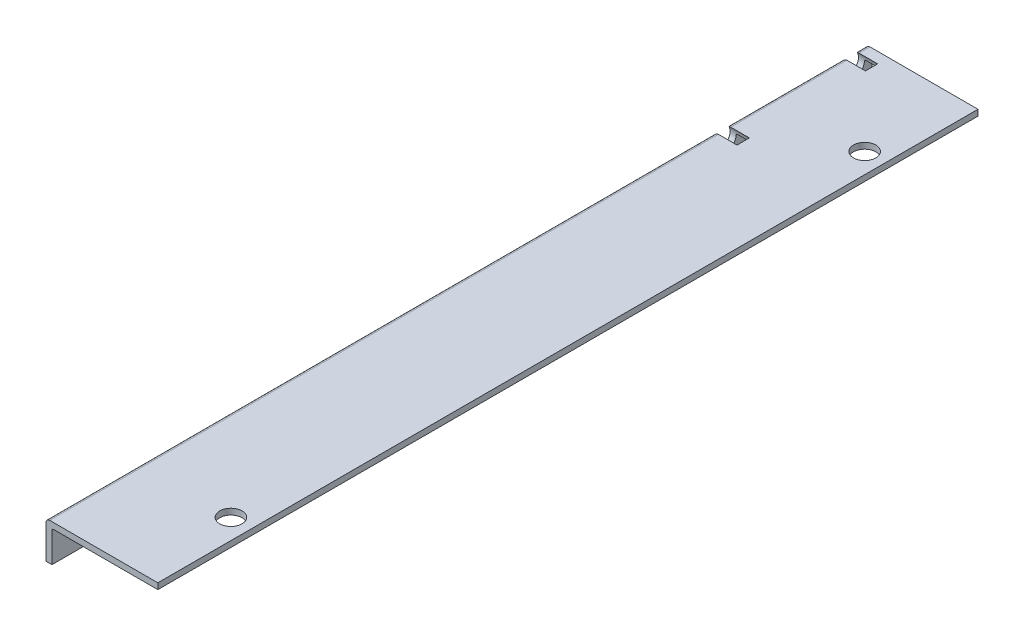
from build123d import *

# Parameters (mm, degrees)
EXTRUDE_1_DEPTH     = 1100
SKETCH_2_R          = 15
CUT_EXTRUDE_1_DEPTH = 10
SKETCH_3_R          = 7
CUT_EXTRUDE_2_DEPTH = 10
SKETCH_4_R          = 12.5
CUT_EXTRUDE_3_DEPTH = 30
SKETCH_5_R          = 7
CUT_EXTRUDE_4_DEPTH = 10


with BuildPart() as part:
    # 草图1 → 凸台-拉伸1 (new body)
    with BuildSketch(Plane.XY):
        with BuildLine():
            Line((0, 0), (0, 45))
            ThreePointArc((0, 45), (1.464466094, 48.535533906), (5, 50))
            Line((5, 50), (150, 50))
            Line((150, 50), (150, 42))
            Line((150, 42), (10, 42))
            ThreePointArc((10, 42), (8.585786438, 41.414213562), (8, 40))
            Line((8, 40), (8, 0))
            Line((8, 0), (0, 0))
        make_face()
    extrude(amount=EXTRUDE_1_DEPTH)

    # 草图2 → 切除-拉伸1 (cut)
    with BuildSketch(Plane(origin=(0, 50, 0), x_dir=(1, 0, 0), z_dir=(0, 1, 0))):
        with Locations(Location((123, -975, 0), (0, 0, 270))):
            Circle(SKETCH_2_R)
        with Locations(Location((123, -125, 0), (0, 0, 270))):
            Circle(SKETCH_2_R)
    extrude(amount=-CUT_EXTRUDE_1_DEPTH, mode=Mode.SUBTRACT)

    # 草图3 → 切除-拉伸2 (cut)
    with BuildSketch(Plane.ZY):
        with Locations((283.54329503, 25.022549618)):
            Circle(SKETCH_3_R)
        with Locations((140.939449508, 19.704656779)):
            Circle(SKETCH_3_R)
        with Locations(Location((22.762519147, 40.542438099, 0), (0, 0, 355.555628173))):
            Circle(SKETCH_3_R)
        with Locations(Location((194.910597259, 40.650885608, 0), (0, 0, 354.6647218))):
            Circle(SKETCH_3_R)
        with Locations((81.850984328, 30.123547439)):
            Circle(SKETCH_3_R)
    extrude(amount=-CUT_EXTRUDE_2_DEPTH, mode=Mode.SUBTRACT)

    # 草图4 → 切除-拉伸3 (cut)
    with BuildSketch(Plane.ZY):
        with Locations((22.762519147, 40.542438099)):
            Circle(SKETCH_4_R)
        with Locations((194.910597259, 40.650885608)):
            Circle(SKETCH_4_R)
    extrude(amount=-CUT_EXTRUDE_3_DEPTH, mode=Mode.SUBTRACT)

    # 草图5 → 切除-拉伸4 (cut)
    with BuildSketch(Plane.ZY):
        with Locations((1000, 25.022549618)):
            Circle(SKETCH_5_R)
        with Locations((700, 25.022549618)):
            Circle(SKETCH_5_R)
    extrude(amount=-CUT_EXTRUDE_4_DEPTH, mode=Mode.SUBTRACT)


solid = part.part
